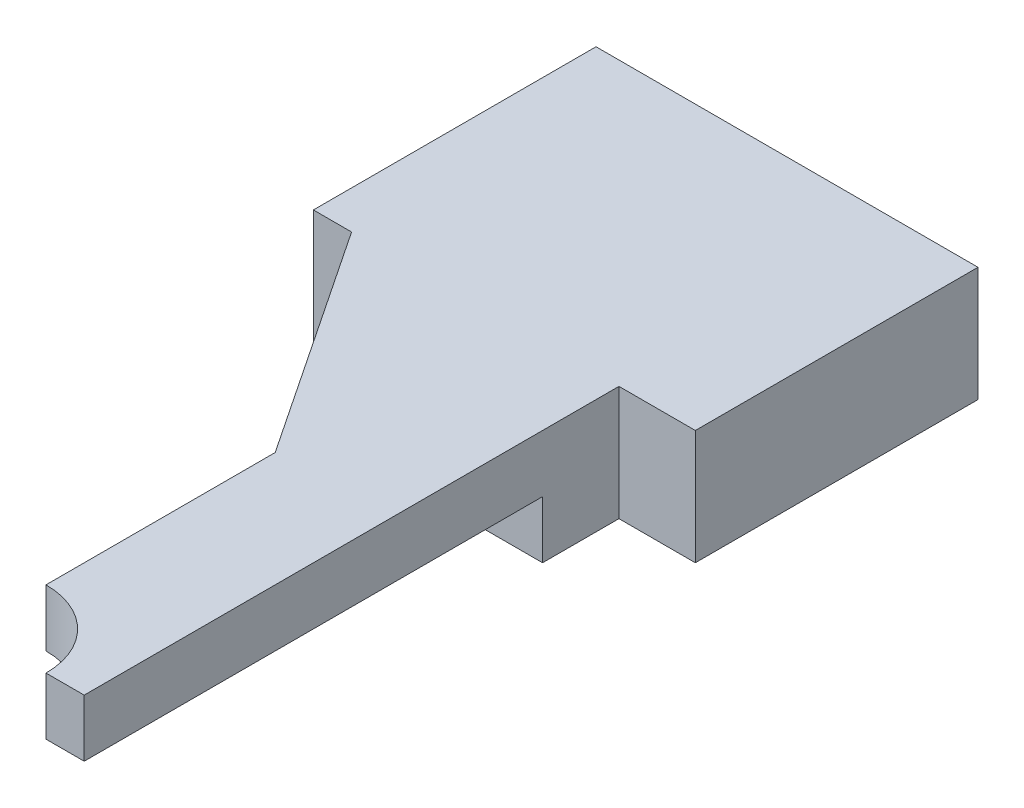
from build123d import *

# Parameters (mm, degrees)
SKETCH_1_W               = 50
SKETCH_1_H               = 15
EXTRUDE_1_DEPTH          = 60
SKETCH_2_W               = 15
SKETCH_2_H               = 15
EXTRUDE_2_DEPTH          = 60
SKETCH_3_W               = 15
SKETCH_3_H               = 7.5
CUT_EXTRUDE_1_DEPTH      = 60
CUT_EXTRUDE_2_DEPTH      = 10
SKETCH_6_W               = 10
SKETCH_6_H               = 10
SKETCH_6_W_2             = 25
CUT_EXTRUDE_3_DEPTH      = 20
EXTRUDE_3_DEPTH          = 7.5
CUT_EXTRUDE_4_DEPTH      = 124.490890352
CUT_EXTRUDE_4_DEPTH_BACK = 124.490890352
SKETCH_7_W               = 82.157848782
SKETCH_7_H               = 26


with BuildPart() as part:
    # 스케치1 → 보스-돌출1 (new body)
    with BuildSketch(Plane.XY):
        Rectangle(SKETCH_1_W, SKETCH_1_H)
    extrude(amount=EXTRUDE_1_DEPTH)

    # 스케치2 → 보스-돌출2 (add)
    with BuildSketch(Plane.XY.offset(60)):
        with Locations((7.5, 0)):
            Rectangle(SKETCH_2_W, SKETCH_2_H)
    extrude(amount=EXTRUDE_2_DEPTH)

    # 스케치3 → 컷-돌출1 (cut)
    with BuildSketch(Plane.XY.offset(120)):
        with Locations((7.5, -3.75)):
            Rectangle(SKETCH_3_W, SKETCH_3_H)
    extrude(amount=-CUT_EXTRUDE_1_DEPTH, mode=Mode.SUBTRACT)

    # 스케치4 → 컷-돌출2 (cut)
    with BuildSketch(Plane(origin=(0, 7.5, 0), x_dir=(1, 0, 0), z_dir=(0, 1, 0))):
        with BuildLine():
            Line((0, -110), (0, -120))
            Line((0, -120), (10, -120))
            ThreePointArc((10, -120), (7.071067812, -112.928932188), (0, -110))
        make_face()
    extrude(amount=-CUT_EXTRUDE_2_DEPTH, mode=Mode.SUBTRACT)

    # 스케치6 → 컷-돌출3 (cut)
    with BuildSketch(Plane(origin=(0, 7.5, 0), x_dir=(1, 0, 0), z_dir=(0, 1, 0))):
        with Locations((20, -55)):
            Rectangle(SKETCH_6_W, SKETCH_6_H)
        with Locations((-12.5, -55)):
            Rectangle(SKETCH_6_W_2, SKETCH_6_H)
    extrude(amount=-CUT_EXTRUDE_3_DEPTH, mode=Mode.SUBTRACT)

    # 스케치5 → 보스-돌출3 (add)
    with BuildSketch(Plane(origin=(0, 7.5, 0), x_dir=(1, 0, 0), z_dir=(0, 1, 0))):
        Polygon((0, -50), (0, -80), (-20, -50), align=None)
    extrude(amount=-EXTRUDE_3_DEPTH)

    # 스케치7 → 컷-돌출4 (cut, two sides: drawn at the far end of the back side and taken through both)
    with BuildSketch(Plane.XZ.offset(7.5).offset(-CUT_EXTRUDE_4_DEPTH_BACK)):
        Rectangle(SKETCH_7_W, SKETCH_7_H)
    extrude(amount=CUT_EXTRUDE_4_DEPTH + CUT_EXTRUDE_4_DEPTH_BACK, mode=Mode.SUBTRACT)


solid = part.part
